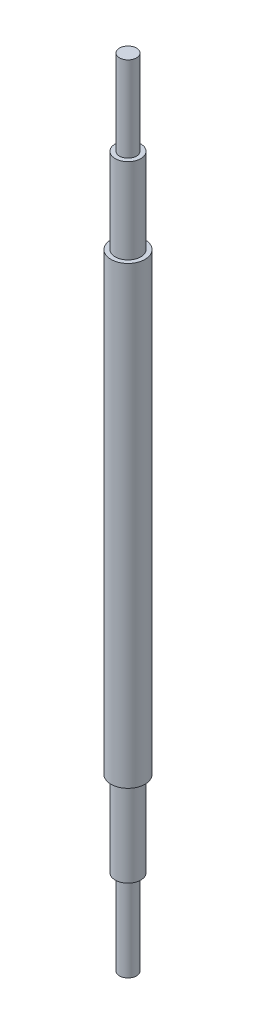
from build123d import *

# Parameters (mm, degrees)
SKETCH_1_R      = 4
EXTRUDE_1_DEPTH = 106.8
SKETCH_2_R      = 3
EXTRUDE_2_DEPTH = 20
SKETCH_3_R      = 2
EXTRUDE_3_DEPTH = 20
EXTRUDE_START   = 20
SKETCH_4_R      = 3
EXTRUDE_4_DEPTH = 20
SKETCH_5_R      = 2
EXTRUDE_5_DEPTH = 20


with BuildPart() as part:
    # 草图1 → 凸台-拉伸1 (new body)
    with BuildSketch(Plane(origin=(0, 0, 0), x_dir=(1, 0, 0), z_dir=(0, 1, 0))):
        with Locations(Location((0, 0, 0), (0, 0, 270))):
            Circle(SKETCH_1_R)
    extrude(amount=EXTRUDE_1_DEPTH)

    # 草图2 → 凸台-拉伸2 (add)
    with BuildSketch(Plane(origin=(0, 106.8, 0), x_dir=(1, 0, 0), z_dir=(0, 1, 0))):
        with Locations(Location((0, 0, 0), (0, 0, 270))):
            Circle(SKETCH_2_R)
    extrude(amount=EXTRUDE_2_DEPTH)

    # 草图3 → 凸台-拉伸3 (add)
    with BuildSketch(Plane(origin=(0, 126.8, 0), x_dir=(1, 0, 0), z_dir=(0, 1, 0))):
        with Locations(Location((0, 0, 0), (0, 0, 270))):
            Circle(SKETCH_3_R)
    extrude(amount=EXTRUDE_3_DEPTH)

    # 草图4 → 凸台-拉伸4 (add)
    with BuildSketch(Plane.XZ.offset(EXTRUDE_START)):
        with Locations(Location((0, 0, 0), (0, 0, 90))):
            Circle(SKETCH_4_R)
    extrude(amount=-EXTRUDE_4_DEPTH)

    # 草图5 → 凸台-拉伸5 (add)
    with BuildSketch(Plane.XZ.offset(20).offset(EXTRUDE_START)):
        with Locations(Location((0, 0, 0), (0, 0, 90))):
            Circle(SKETCH_5_R)
    extrude(amount=-EXTRUDE_5_DEPTH)


solid = part.part
